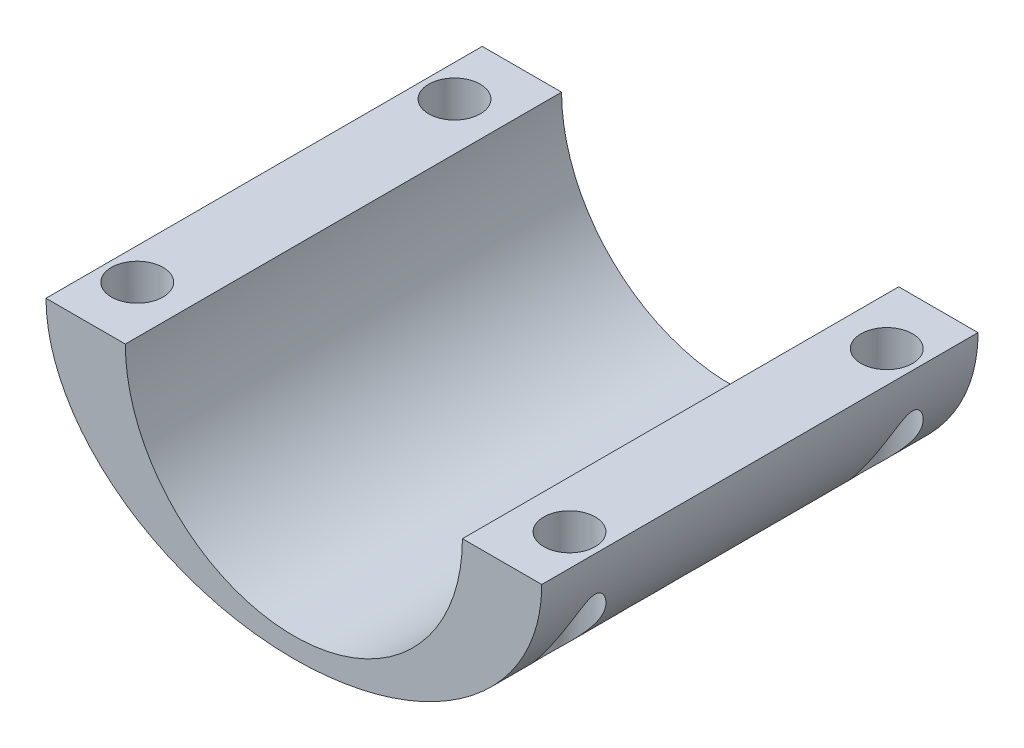
from build123d import *

# Parameters (mm, degrees)
BOSS_EXTRU_1_DEPTH      = 22
ESQUISSE2_R             = 1.3
ENL_V_MAT_EXTRU_1_DEPTH = 39.748101928


with BuildPart() as part:
    # Esquisse1 → Boss.-Extru.1 (new body)
    with BuildSketch(Plane.XY):
        with BuildLine():
            add(Edge.make_bspline(
                [(-30.449390644, 0), (-30.449390644, -9.5), (-17.949390644, -9.5)],
                knots=[3.141592654, 3.141592654, 3.141592654, 4.71238898, 4.71238898, 4.71238898], degree=2, weights=[1, 0.707106781, 1]))
            add(Edge.make_bspline(
                [(-17.949390644, -9.5), (-5.449390644, -9.5), (-5.449390644, 0)],
                knots=[4.71238898, 4.71238898, 4.71238898, 6.283185307, 6.283185307, 6.283185307], degree=2, weights=[1, 0.707106781, 1]))
            Line((-5.449390644, 0), (-9.449390644, 0))
            ThreePointArc((-9.449390644, 0), (-17.949390644, -8.5), (-26.449390644, 0))
            Line((-26.449390644, 0), (-30.449390644, 0))
        make_face()
    extrude(amount=BOSS_EXTRU_1_DEPTH)

    # Esquisse2 → Enlèv. mat.-Extru.1 (cut, through all)
    with BuildSketch(Plane(origin=(0, 0, 0), x_dir=(1, 0, 0), z_dir=(0, 1, 0))):
        with Locations(Location((-28.849390644, -3, 0), (0, 0, 270))):
            Circle(ESQUISSE2_R)
        with Locations(Location((-28.849390644, -19, 0), (0, 0, 270))):
            Circle(ESQUISSE2_R)
        with Locations(Location((-7.049390644, -3, 0), (0, 0, 270))):
            Circle(ESQUISSE2_R)
        with Locations(Location((-7.049390644, -19, 0), (0, 0, 270))):
            Circle(ESQUISSE2_R)
    extrude(amount=-ENL_V_MAT_EXTRU_1_DEPTH, mode=Mode.SUBTRACT)


solid = part.part
